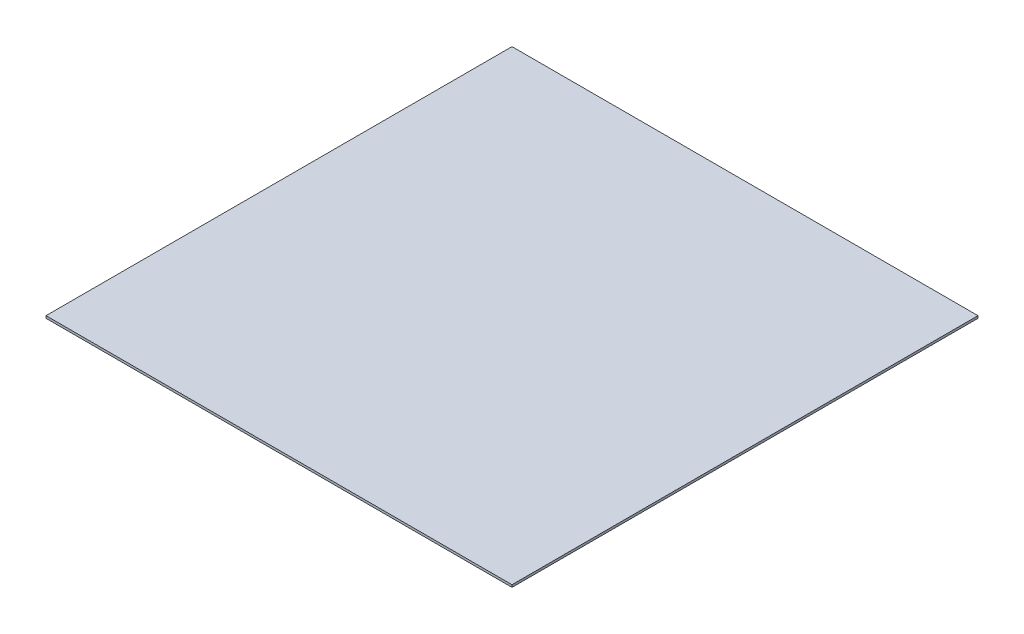
from build123d import *

# Parameters (mm, degrees)
SKETCH1_W           = 600
SKETCH1_H           = 600
BOSS_EXTRUDE1_DEPTH = 1.5


with BuildPart() as part:
    # Sketch1 → Boss-Extrude1 (new, symmetric)
    with BuildSketch(Plane(origin=(0, 0, 0), x_dir=(1, 0, 0), z_dir=(0, 1, 0))):
        Rectangle(SKETCH1_W, SKETCH1_H)
    extrude(amount=BOSS_EXTRUDE1_DEPTH, both=True)


solid = part.part
